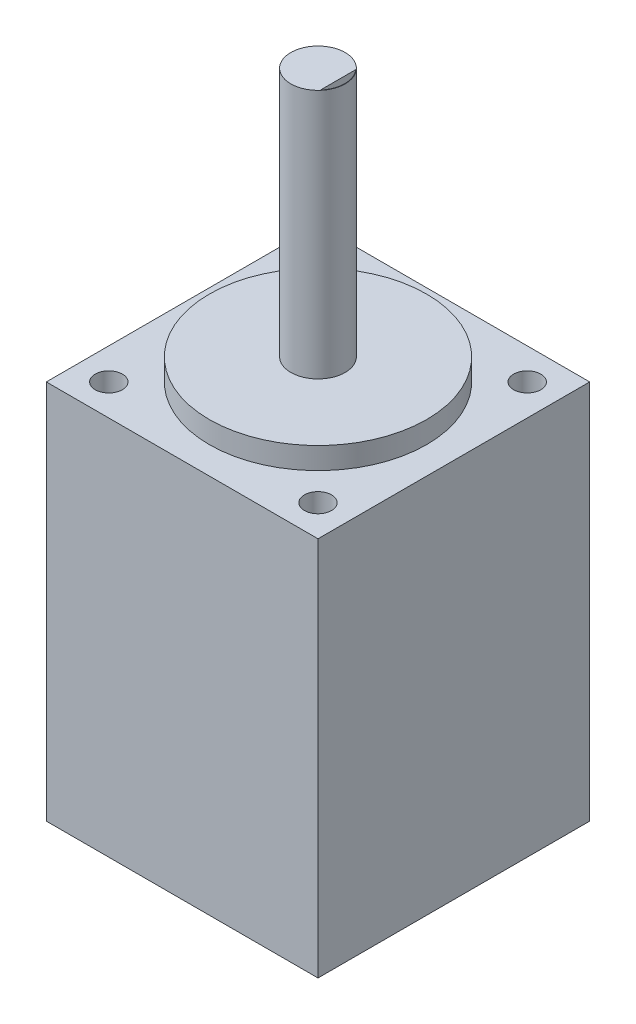
from build123d import *

# Parameters (mm, degrees)
SKETCH_1_W          = 20
SKETCH_1_H          = 20
SKETCH_1_R          = 1
EXTRUDE_1_DEPTH     = 28
EXTRUDE_2_DEPTH     = 1.6
SKETCH_3_R          = 2
EXTRUDE_3_DEPTH     = 18.4
CUT_EXTRUDE_1_DEPTH = 15


with BuildPart() as part:
    # 草图1 → 凸台-拉伸1 (new body)
    with BuildSketch(Plane(origin=(0, 0, 0), x_dir=(1, 0, 0), z_dir=(0, 1, 0))):
        with Locations((10, 10)):
            Rectangle(SKETCH_1_W, SKETCH_1_H)
        with Locations(Location((17.7, 2.3, 0), (0, 0, 270))):
            Circle(SKETCH_1_R, mode=Mode.SUBTRACT)
        with Locations(Location((17.7, 17.7, 0), (0, 0, 270))):
            Circle(SKETCH_1_R, mode=Mode.SUBTRACT)
        with Locations(Location((2.3, 17.7, 0), (0, 0, 270))):
            Circle(SKETCH_1_R, mode=Mode.SUBTRACT)
        with Locations(Location((2.3, 2.3, 0), (0, 0, 270))):
            Circle(SKETCH_1_R, mode=Mode.SUBTRACT)
    extrude(amount=EXTRUDE_1_DEPTH)

    # 草图2 → 凸台-拉伸2 (add)
    with BuildSketch(Plane(origin=(0, 28, 0), x_dir=(1, 0, 0), z_dir=(0, 1, 0))):
        with BuildLine():
            ThreePointArc((2, 10), (10, 2), (18, 10))
            Line((18, 10), (2, 10))
        make_face()
        with BuildLine():
            Line((2, 10), (18, 10))
            ThreePointArc((18, 10), (10, 18), (2, 10))
        make_face()
    extrude(amount=EXTRUDE_2_DEPTH)

    # 草图3 → 凸台-拉伸3 (add)
    with BuildSketch(Plane(origin=(0, 29.6, 0), x_dir=(1, 0, 0), z_dir=(0, 1, 0))):
        with Locations(Location((10, 10, 0), (0, 0, 270))):
            Circle(SKETCH_3_R)
    extrude(amount=EXTRUDE_3_DEPTH)

    # 草图4 → 切除-拉伸1 (cut)
    with BuildSketch(Plane(origin=(0, 48, 0), x_dir=(1, 0, 0), z_dir=(0, 1, 0))):
        with BuildLine():
            Line((11.481279617, 11.304155273), (11.481279617, 10))
            Line((11.481279617, 10), (11.481279617, 8.695844727))
            ThreePointArc((11.481279617, 8.695844727), (11.846406131, 9.303010274), (11.97357804, 10))
            ThreePointArc((11.97357804, 10), (11.846406131, 10.696989726), (11.481279617, 11.304155273))
        make_face()
    extrude(amount=-CUT_EXTRUDE_1_DEPTH, mode=Mode.SUBTRACT)


solid = part.part
